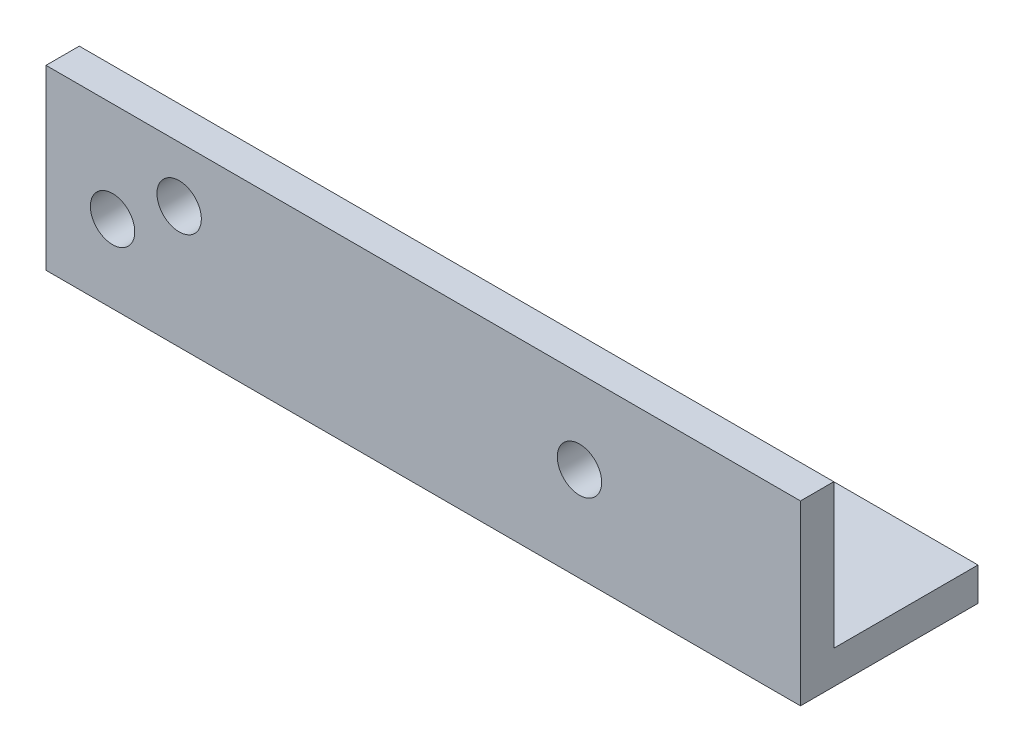
from build123d import *

# Parameters (mm, degrees)
BOSS_EXTRUDE1_DEPTH = 107.95
CUT_EXTRUDE1_REACH  = 114.802
SKETCH3_R           = 3.175
CUT_EXTRUDE2_REACH  = 115.77
SKETCH4_R           = 3.175
CUT_EXTRUDE4_REACH  = 115.77
SKETCH5_R           = 3.175


with BuildPart() as part:
    # Sketch1 → Boss-Extrude1 (new body)
    with BuildSketch(Plane(origin=(0, 0, 0), x_dir=(0, 0, -1), z_dir=(1, 0, 0))):
        Polygon((0, 0), (0, -25.4), (25.4, -25.4), (25.4, -20.6375), (4.7625, -20.6375), (4.7625, 0), align=None)
    extrude(amount=BOSS_EXTRUDE1_DEPTH)

    # Sketch3 → Cut-Extrude1 (cut, up to next)
    with BuildSketch(Plane(origin=(0, 0, -4.7625), x_dir=(-1, 0, 0), z_dir=(0, 0, -1)), mode=Mode.PRIVATE) as cut_extrude1_sk1:
        with Locations(Location((-9.525, -14.2875, 0), (0, 0, 90))):
            Circle(SKETCH3_R)
    cut_extrude1_tool1 = extrude(cut_extrude1_sk1.sketch, amount=-CUT_EXTRUDE1_REACH, mode=Mode.PRIVATE) & part.part
    # Sketch3 → Cut-Extrude1 (cut, up to next)
    with BuildSketch(Plane(origin=(0, 0, -4.7625), x_dir=(-1, 0, 0), z_dir=(0, 0, -1)), mode=Mode.PRIVATE) as cut_extrude1_sk2:
        with Locations(Location((-19.05, -7.9375, 0), (0, 0, 90))):
            Circle(SKETCH3_R)
    cut_extrude1_tool2 = extrude(cut_extrude1_sk2.sketch, amount=-CUT_EXTRUDE1_REACH, mode=Mode.PRIVATE) & part.part
    add(cut_extrude1_tool1.solids().sort_by_distance((9.525, -14.2875, -4.7625))[0], mode=Mode.SUBTRACT)
    add(cut_extrude1_tool2.solids().sort_by_distance((19.05, -7.9375, -4.7625))[0], mode=Mode.SUBTRACT)

    # Sketch4 → Cut-Extrude2 (cut, up to next)
    with BuildSketch(Plane.XY, mode=Mode.PRIVATE) as cut_extrude2_sk1:
        with Locations((76.332177029, -11.929615818)):
            Circle(SKETCH4_R)
    cut_extrude2_tool1 = extrude(cut_extrude2_sk1.sketch, amount=-CUT_EXTRUDE2_REACH, mode=Mode.PRIVATE) & part.part
    add(cut_extrude2_tool1.solids().sort_by_distance((76.332177, -11.929616, 0))[0], mode=Mode.SUBTRACT)

    # Sketch5 → Cut-Extrude4 (cut, up to next)
    with BuildSketch(Plane.XZ.offset(25.4), mode=Mode.PRIVATE) as cut_extrude4_sk1:
        with Locations(Location((69.85, -12.7, 0), (0, 0, 270))):
            Circle(SKETCH5_R)
    cut_extrude4_tool1 = extrude(cut_extrude4_sk1.sketch, amount=-CUT_EXTRUDE4_REACH, mode=Mode.PRIVATE) & part.part
    # Sketch5 → Cut-Extrude4 (cut, up to next)
    with BuildSketch(Plane.XZ.offset(25.4), mode=Mode.PRIVATE) as cut_extrude4_sk2:
        with Locations(Location((95.25, -12.7, 0), (0, 0, 270))):
            Circle(SKETCH5_R)
    cut_extrude4_tool2 = extrude(cut_extrude4_sk2.sketch, amount=-CUT_EXTRUDE4_REACH, mode=Mode.PRIVATE) & part.part
    add(cut_extrude4_tool1.solids().sort_by_distance((69.85, -25.4, -12.7))[0], mode=Mode.SUBTRACT)
    add(cut_extrude4_tool2.solids().sort_by_distance((95.25, -25.4, -12.7))[0], mode=Mode.SUBTRACT)


solid = part.part
